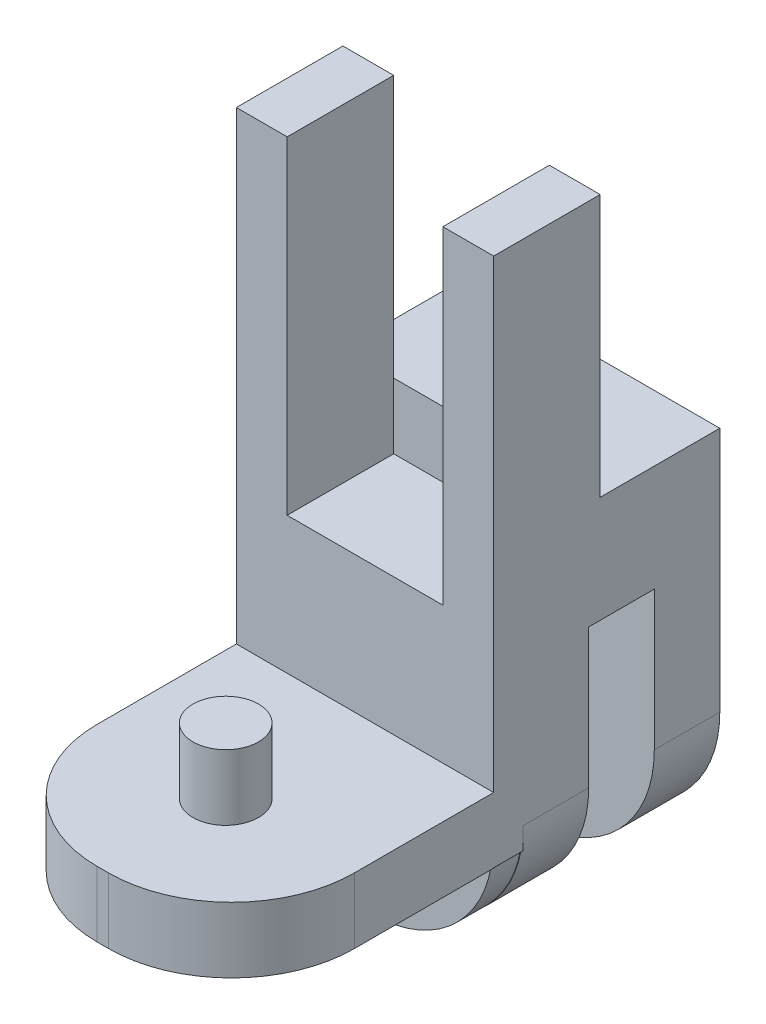
from build123d import *

# Parameters (mm, degrees)
SKETCH4_W            = 31.4
SKETCH4_H            = 31.4
SKETCH4_W_2          = 25.4
SKETCH4_H_2          = 25.4
BOSS_EXTRUDE3_DEPTH  = 30
SKETCH5_W            = 31.4
SKETCH5_H            = 31.4
BOSS_EXTRUDE4_DEPTH  = 5
SKETCH6_W            = 31.4
SKETCH6_H            = 8
BOSS_EXTRUDE5_DEPTH  = 5
BOSS_EXTRUDE6_DEPTH  = 8
SKETCH8_R            = 4
BOSS_EXTRUDE7_DEPTH  = 8
SKETCH9_W            = 31.4
SKETCH9_H            = 10
BOSS_EXTRUDE8_DEPTH  = 5
SKETCH10_W           = 31.4
SKETCH10_H           = 10
BOSS_EXTRUDE9_DEPTH  = 13
SKETCH11_W           = 6.2
SKETCH11_H           = 10
BOSS_EXTRUDE10_DEPTH = 40
BOSS_EXTRUDE11_DEPTH = 3
SKETCH13_W           = 31.4
SKETCH13_H           = 31.4
CUT_EXTRUDE1_DEPTH   = 31.4
SKETCH15_R           = 4
BOSS_EXTRUDE12_DEPTH = 8
SKETCH16_W           = 31.4
SKETCH16_H           = 13
BOSS_EXTRUDE13_DEPTH = 4.6
SKETCH17_W           = 31.4
SKETCH17_H           = 3.6
BOSS_EXTRUDE14_DEPTH = 0.6
CUT_EXTRUDE2_DEPTH   = 3.6


with BuildPart() as part:
    # Sketch4 → Boss-Extrude3 (new body)
    with BuildSketch(Plane.XY):
        Rectangle(SKETCH4_W, SKETCH4_H)
        Rectangle(SKETCH4_W_2, SKETCH4_H_2, mode=Mode.SUBTRACT)
    extrude(amount=BOSS_EXTRUDE3_DEPTH)

    # Sketch5 → Boss-Extrude4 (add)
    with BuildSketch(Plane.XY.offset(30)):
        Rectangle(SKETCH5_W, SKETCH5_H)
    extrude(amount=BOSS_EXTRUDE4_DEPTH)

    # Sketch6 → Boss-Extrude5 (add)
    with BuildSketch(Plane.XY.offset(35)):
        Rectangle(SKETCH6_W, SKETCH6_H)
    extrude(amount=BOSS_EXTRUDE5_DEPTH)

    # Sketch7 → Boss-Extrude6 (add)
    with BuildSketch(Plane.XZ.offset(4)):
        with BuildLine():
            Line((-15.7, 40), (-15.7, 52))
            ThreePointArc((-15.7, 52), (-11.306601718, 62.606601718), (-0.7, 67))
            Line((-0.7, 67), (0.7, 67))
            ThreePointArc((0.7, 67), (11.306601718, 62.606601718), (15.7, 52))
            Line((15.7, 52), (15.7, 40))
            Line((15.7, 40), (-15.7, 40))
        make_face()
    extrude(amount=-BOSS_EXTRUDE6_DEPTH)

    # Sketch8 → Boss-Extrude7 (add)
    with BuildSketch(Plane.XZ.offset(4)):
        with Locations(Location((0, 52, 0), (0, 0, 180))):
            Circle(SKETCH8_R)
    boss_extrude7 = extrude(amount=BOSS_EXTRUDE7_DEPTH)

    # Mirror1: Boss-Extrude7 across plane
    add(boss_extrude7.mirror(Plane.ZX))

    # Sketch9 → Boss-Extrude8 (add)
    with BuildSketch(Plane(origin=(0, 15.7, 0), x_dir=(1, 0, 0), z_dir=(0, 1, 0))):
        with Locations((0, -27)):
            Rectangle(SKETCH9_W, SKETCH9_H)
    extrude(amount=BOSS_EXTRUDE8_DEPTH)

    # Sketch10 → Boss-Extrude9 (add)
    with BuildSketch(Plane(origin=(0, 15.7, 0), x_dir=(1, 0, 0), z_dir=(0, 1, 0))):
        with Locations((0, -17)):
            Rectangle(SKETCH10_W, SKETCH10_H)
    extrude(amount=BOSS_EXTRUDE9_DEPTH)

    # Sketch11 → Boss-Extrude10 (add)
    with BuildSketch(Plane(origin=(0, 20.7, 0), x_dir=(1, 0, 0), z_dir=(0, 1, 0))):
        with Locations((-12.6, -27)):
            Rectangle(SKETCH11_W, SKETCH11_H)
        with Locations((12.6, -27)):
            Rectangle(SKETCH11_W, SKETCH11_H)
    extrude(amount=BOSS_EXTRUDE10_DEPTH)

    # Sketch12 → Boss-Extrude11 (add)
    with BuildSketch(Plane.XY.offset(32)):
        Polygon((-15.7, 60.7), (-9.5, 60.7), (-9.5, 20.7), (9.5, 20.7), (9.5, 60.7), (15.7, 60.7), (15.7, 15.7), (-15.7, 15.7), align=None)
    extrude(amount=BOSS_EXTRUDE11_DEPTH)

    # Sketch13 → Cut-Extrude1 (cut)
    with BuildSketch(Plane.ZY.offset(15.7)):
        with Locations((15.7, 0)):
            Rectangle(SKETCH13_W, SKETCH13_H)
    extrude(amount=-CUT_EXTRUDE1_DEPTH, mode=Mode.SUBTRACT)

    # Sketch15 → Boss-Extrude12 (add)
    with BuildSketch(Plane(origin=(0, 0, 31.4), x_dir=(-1, 0, 0), z_dir=(0, 0, -1))):
        with BuildLine():
            Line((15.7, -1.3), (15.7, 15.7))
            Line((15.7, 15.7), (-15.7, 15.7))
            Line((-15.7, 15.7), (-15.7, -1.3))
            ThreePointArc((-15.7, -1.3), (-11.306601718, -11.906601718), (-0.7, -16.3))
            Line((-0.7, -16.3), (0.7, -16.3))
            ThreePointArc((0.7, -16.3), (11.306601718, -11.906601718), (15.7, -1.3))
        make_face()
        with Locations(Location((0, -1.3, 0), (0, 0, 90))):
            Circle(SKETCH15_R, mode=Mode.SUBTRACT)
    boss_extrude12 = extrude(amount=BOSS_EXTRUDE12_DEPTH)

    # Mirror2: Boss-Extrude12 across plane
    add(boss_extrude12.mirror(Plane(origin=(0, 0, 19.4), x_dir=(1, 0, 0), z_dir=(0, 0, -1))))

    # Sketch16 → Boss-Extrude13 (add)
    with BuildSketch(Plane(origin=(0, 0, 12), x_dir=(-1, 0, 0), z_dir=(0, 0, -1))):
        with Locations((0, 22.2)):
            Rectangle(SKETCH16_W, SKETCH16_H)
    extrude(amount=BOSS_EXTRUDE13_DEPTH)

    # Sketch17 → Boss-Extrude14 (add)
    with BuildSketch(Plane.XZ.offset(15.7)):
        with Locations((0, 33.2)):
            Rectangle(SKETCH17_W, SKETCH17_H)
    extrude(amount=BOSS_EXTRUDE14_DEPTH)

    # Sketch24 → Cut-Extrude2 (cut)
    with BuildSketch(Plane(origin=(0, 0, 31.4), x_dir=(-1, 0, 0), z_dir=(0, 0, -1))):
        with BuildLine():
            Line((-15.7, -3.955876224), (-15.7, -16.3))
            Line((-15.7, -16.3), (-0.7, -16.3))
            ThreePointArc((-0.7, -16.3), (-10.301298901, -12.800983891), (-15.399984201, -3.944829955))
            Line((-15.399984201, -3.944829955), (-15.7, -3.955876224))
        make_face()
    cut_extrude2 = extrude(amount=-CUT_EXTRUDE2_DEPTH, mode=Mode.SUBTRACT)

    # Mirror3: Cut-Extrude2 across plane
    add(cut_extrude2.mirror(Plane(origin=(0, 0, 0), x_dir=(0, 0, 1), z_dir=(1, 0, 0))), mode=Mode.SUBTRACT)


solid = part.part
